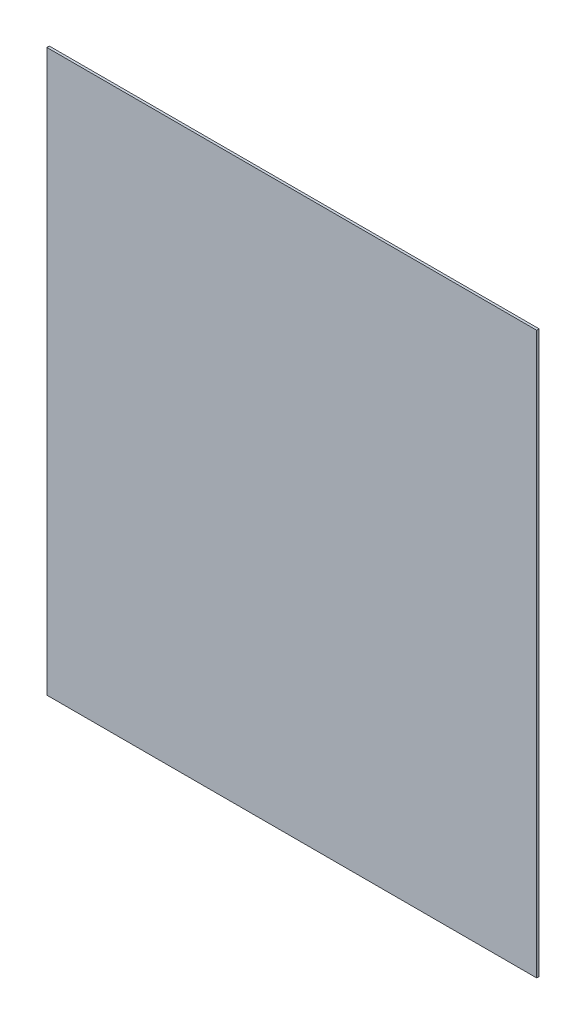
from build123d import *

# Parameters (mm, degrees)
SKETCH2_W           = 508
SKETCH2_H           = 581.66
BOSS_EXTRUDE1_DEPTH = 2.54


with BuildPart() as part:
    # Sketch2 → Boss-Extrude1 (new body)
    with BuildSketch(Plane.XY):
        Rectangle(SKETCH2_W, SKETCH2_H)
    extrude(amount=BOSS_EXTRUDE1_DEPTH)


solid = part.part
